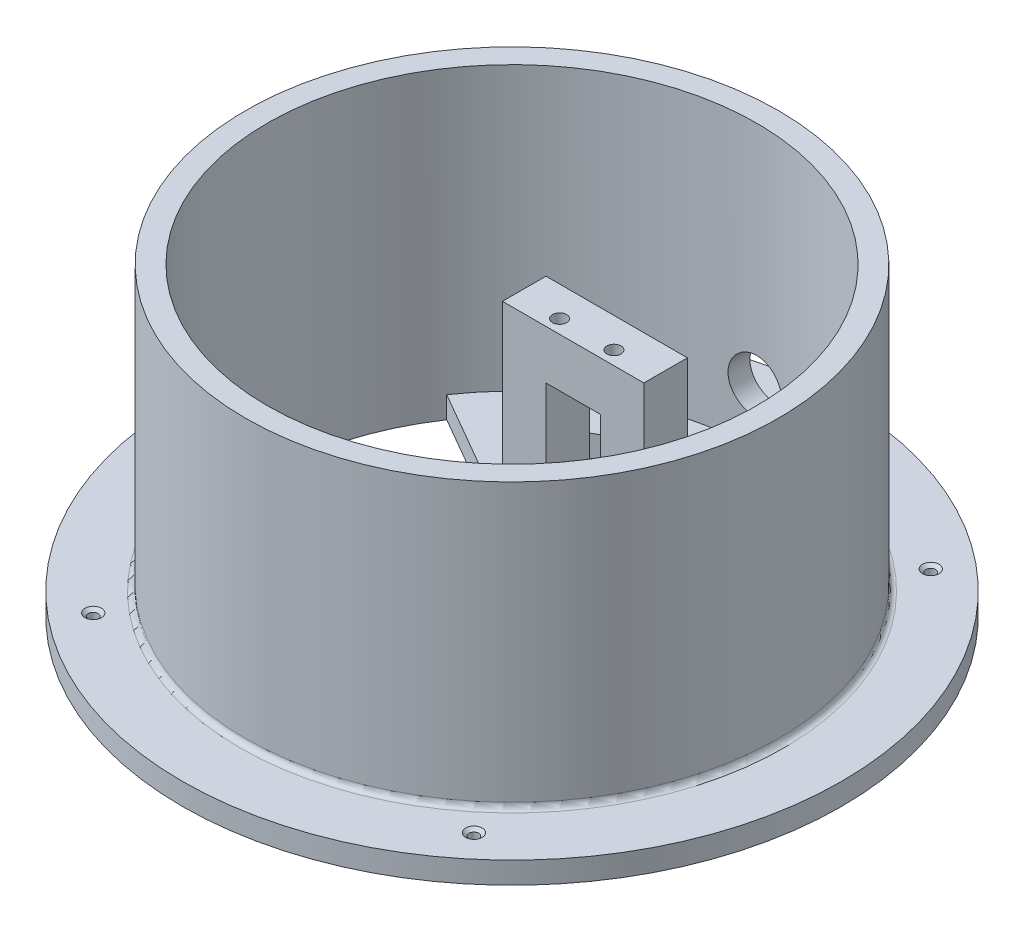
from build123d import *

# Parameters (mm, degrees)
SKETCH1_R                                         = 60.625
SKETCH1_R_2                                       = 45
BOSS_EXTRUDE1_DEPTH                               = 4
SKETCH2_R                                         = 49
SKETCH2_R_2                                       = 45
BOSS_EXTRUDE2_DEPTH                               = 52
SKETCH3_W                                         = 8
SKETCH3_H                                         = 38
BOSS_EXTRUDE3_DEPTH                               = 13
SKETCH5_W                                         = 10
SKETCH5_H                                         = 24
CUT_EXTRUDE1_DEPTH                                = 23
SKETCH6_R                                         = 5
CUT_EXTRUDE2_DEPTH                                = 60
SKETCH7_R                                         = 1.3
CUT_EXTRUDE3_DEPTH                                = 7.2
BOSS_EXTRUDE4_DEPTH                               = 4
CSK_FOR_0_FLAT_HEAD_MACHINE_SCREW_100_D           = 1.778
CSK_FOR_0_FLAT_HEAD_MACHINE_SCREW_100_CSINK_D     = 3.0226
CSK_FOR_0_FLAT_HEAD_MACHINE_SCREW_100_CSINK_ANGLE = 100
FILLET1_R                                         = 1


with BuildPart() as part:
    # Sketch1 → Boss-Extrude1 (new body)
    with BuildSketch(Plane(origin=(0, 0, 0), x_dir=(1, 0, 0), z_dir=(0, 1, 0))):
        with Locations(Location((0, 0, 0), (0, 0, 270))):
            Circle(SKETCH1_R)
        with Locations(Location((0, 0, 0), (0, 0, 270))):
            Circle(SKETCH1_R_2, mode=Mode.SUBTRACT)
    extrude(amount=BOSS_EXTRUDE1_DEPTH)

    # Sketch2 → Boss-Extrude2 (add)
    with BuildSketch(Plane(origin=(0, 4, 0), x_dir=(1, 0, 0), z_dir=(0, 1, 0))):
        with Locations(Location((0, 0, 0), (0, 0, 90))):
            Circle(SKETCH2_R)
        with Locations(Location((0, 0, 0), (0, 0, 270))):
            Circle(SKETCH2_R_2, mode=Mode.SUBTRACT)
    extrude(amount=BOSS_EXTRUDE2_DEPTH)

    # Sketch3 → Boss-Extrude3 (add, symmetric)
    with BuildSketch(Plane(origin=(0, 0, 0), x_dir=(0, 0, -1), z_dir=(1, 0, 0))):
        Polygon((-45, 38), (-31.75, 38), (-31.75, 30), (-45, 16.75), align=None)
        with Locations((15.25, 19)):
            Rectangle(SKETCH3_W, SKETCH3_H)
    extrude(amount=BOSS_EXTRUDE3_DEPTH, both=True)


with BuildPart() as boss_extrude3_piece_1:
    # of the separate pieces the step leaves, piece 1, a body of its own (boss_extrude3_pieces)
    add(part.part.solids().sort_by_distance((0, 0, 60.625))[0])

    # Sketch6 → Cut-Extrude2 (cut)
    with BuildSketch(Plane.XY.offset(-11.25)):
        with Locations(Location((0, 14, 0), (0, 0, 90))):
            Circle(SKETCH6_R)
    extrude(amount=-CUT_EXTRUDE2_DEPTH, mode=Mode.SUBTRACT)


with BuildPart() as boss_extrude3_piece_2:
    # of the separate pieces the step leaves, piece 2, a body of its own (boss_extrude3_pieces)
    add(part.part.solids().sort_by_distance((-13, 0, -19.25))[0])

    # Sketch5 → Cut-Extrude1 (cut)
    with BuildSketch(Plane.XY.offset(-11.25)):
        with Locations((0, 17)):
            Rectangle(SKETCH5_W, SKETCH5_H)
    extrude(amount=-CUT_EXTRUDE1_DEPTH, mode=Mode.SUBTRACT)


with BuildPart() as cut_extrude3_tool:
    # Sketch7 → Cut-Extrude3 (new body)
    with BuildSketch(Plane(origin=(0, 38, 0), x_dir=(1, 0, 0), z_dir=(0, 1, 0))):
        with Locations(Location((-5, 13.75, 0), (0, 0, 270))):
            Circle(SKETCH7_R)
        with Locations(Location((5, 13.75, 0), (0, 0, 270))):
            Circle(SKETCH7_R)
        with Locations(Location((5, -34.25, 0), (0, 0, 270))):
            Circle(SKETCH7_R)
        with Locations(Location((-5, -34.25, 0), (0, 0, 270))):
            Circle(SKETCH7_R)
    extrude(amount=-CUT_EXTRUDE3_DEPTH)


with BuildPart() as boss_extrude3_piece_1_1:
    add(boss_extrude3_piece_1.part)

    # Cut-Extrude3: cut by cut_extrude3_tool
    add(cut_extrude3_tool.part, mode=Mode.SUBTRACT)



with BuildPart() as boss_extrude3_piece_2_1:
    add(boss_extrude3_piece_2.part)

    # Cut-Extrude3: cut by cut_extrude3_tool
    add(cut_extrude3_tool.part, mode=Mode.SUBTRACT)


with BuildPart() as boss_extrude3_piece_1_2:
    add(boss_extrude3_piece_1_1.part)

    add(boss_extrude3_piece_2_1.part)  # Boss-Extrude4 merges Boss-Extrude3 piece 2
    # Sketch8 → Boss-Extrude4 (add)
    with BuildSketch(Plane.XZ):
        with BuildLine():
            Line((13, -11.25), (-13, -11.25))
            Line((-13, -11.25), (-37.248431585, -25.249838503))
            ThreePointArc((-37.248431585, -25.249838503), (0, -45), (37.248431585, -25.249838503))
            Line((37.248431585, -25.249838503), (13, -11.25))
        make_face()
        with BuildLine():
            Line((19.516660498, -24.25), (24.906460381, -27.361802413))
            ThreePointArc((24.906460381, -27.361802413), (0, -37), (-24.906460381, -27.361802413))
            Line((-24.906460381, -27.361802413), (-19.516660498, -24.25))
            Line((-19.516660498, -24.25), (19.516660498, -24.25))
        make_face(mode=Mode.SUBTRACT)
    extrude(amount=-BOSS_EXTRUDE4_DEPTH)

    # CSK for #0 Flat Head Machine Screw (100)1 (through all)
    with Locations(Plane(origin=(0, 4, 0), x_dir=(1, 0, 0), z_dir=(0, 1, 0))):
        with Locations((-35, 42), (35, 42), (35, -42), (-35, -42)):
            CounterSinkHole(CSK_FOR_0_FLAT_HEAD_MACHINE_SCREW_100_D / 2, CSK_FOR_0_FLAT_HEAD_MACHINE_SCREW_100_CSINK_D / 2, counter_sink_angle=CSK_FOR_0_FLAT_HEAD_MACHINE_SCREW_100_CSINK_ANGLE)

    # Fillet1
    fillet1_edges = [boss_extrude3_piece_1_2.edges().sort_by_distance(p)[0] for p in [
        (0, 4, 49),
    ]]
    fillet(fillet1_edges, radius=FILLET1_R)


solid = boss_extrude3_piece_1_2.part
